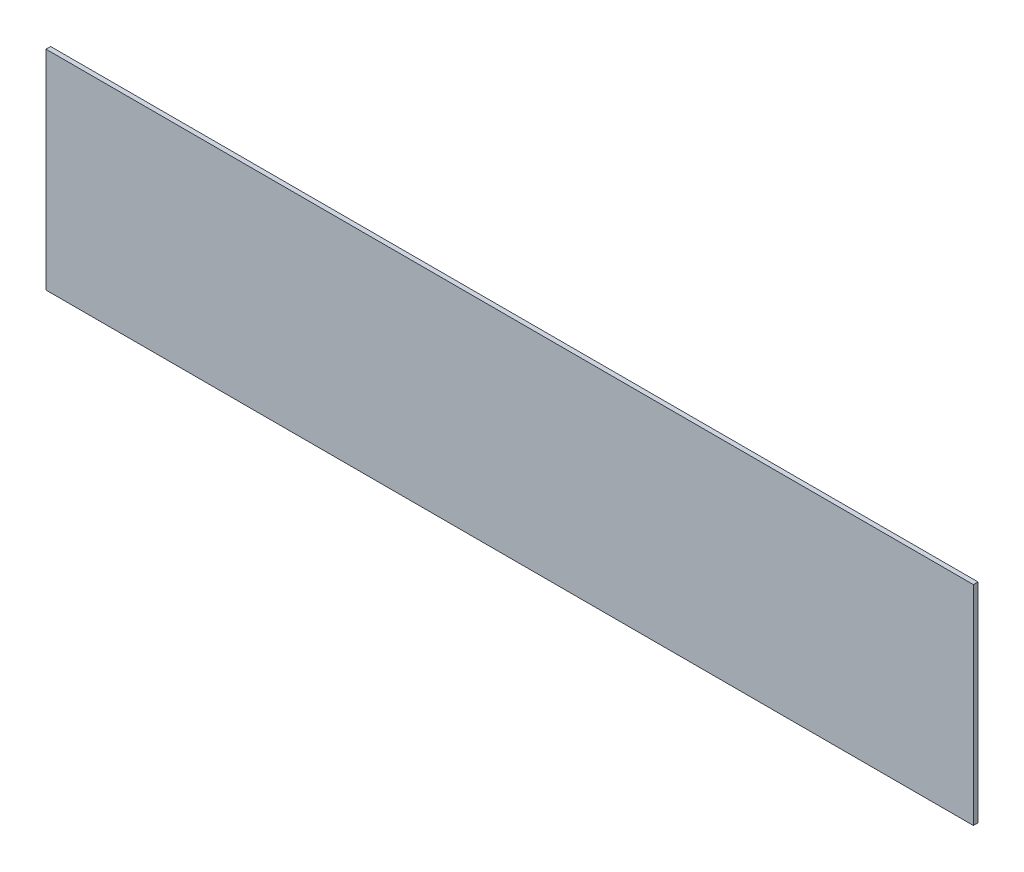
from build123d import *

# Parameters (mm, degrees)
SKETCH2_W           = 2
SKETCH2_H           = 90
BOSS_EXTRUDE1_DEPTH = 400


with BuildPart() as part:
    # Sketch2 → Boss-Extrude1 (new body)
    with BuildSketch(Plane(origin=(0, 0, 0), x_dir=(0, 0, -1), z_dir=(1, 0, 0))):
        with Locations((1, 45)):
            Rectangle(SKETCH2_W, SKETCH2_H)
    extrude(amount=BOSS_EXTRUDE1_DEPTH)


solid = part.part
